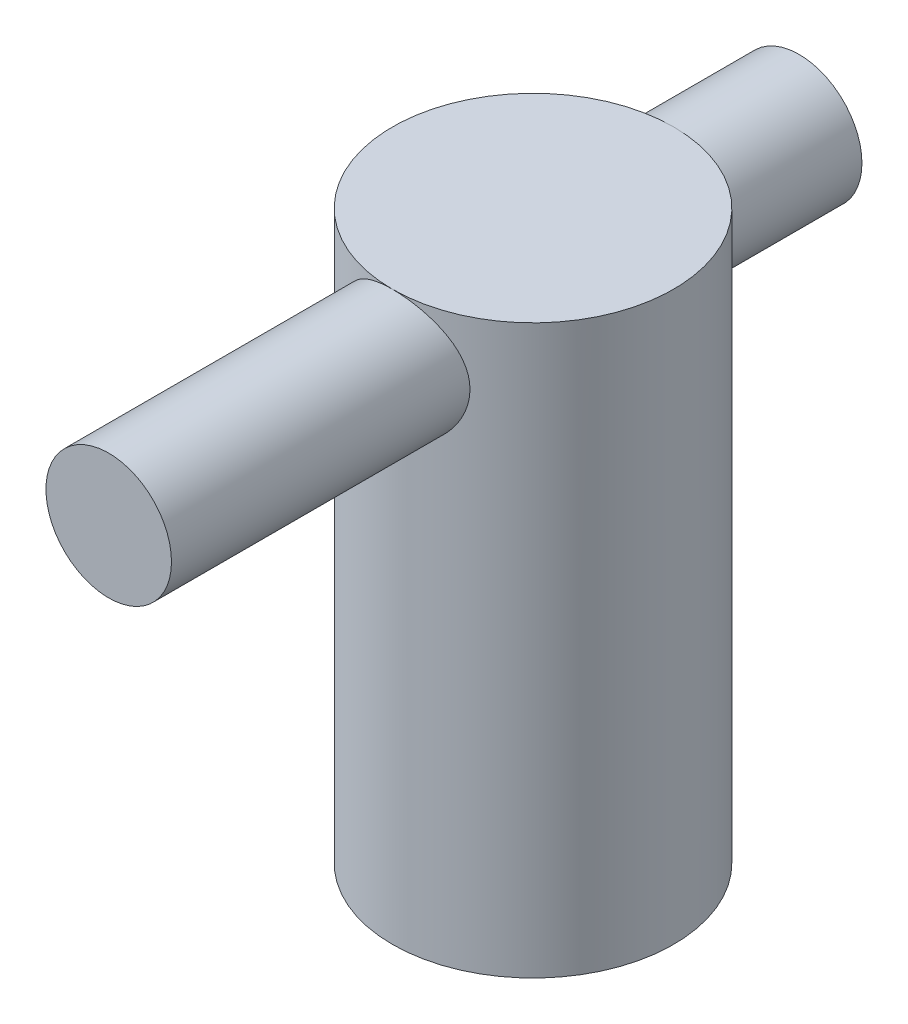
from build123d import *

# Parameters (mm, degrees)
SKETCH2_R                = 14.224
BOSS_EXTRUDE1_DEPTH      = 57.404
BOSS_EXTRUDE2_DEPTH      = 28.702
BOSS_EXTRUDE2_DEPTH_BACK = 41.148
SKETCH3_R                = 6.35


with BuildPart() as part:
    # Sketch2 → Boss-Extrude1 (new body)
    with BuildSketch(Plane(origin=(0, 0, 0), x_dir=(1, 0, 0), z_dir=(0, 1, 0))):
        with Locations(Location((0, 0, 0), (0, 0, 270))):
            Circle(SKETCH2_R)
    extrude(amount=BOSS_EXTRUDE1_DEPTH)

    # Sketch3 → Boss-Extrude2 (add, two sides: drawn at the far end of the back side and taken through both)
    with BuildSketch(Plane.XY.offset(14.224).offset(-BOSS_EXTRUDE2_DEPTH_BACK)):
        with Locations((0, 51.054)):
            Circle(SKETCH3_R)
    extrude(amount=BOSS_EXTRUDE2_DEPTH + BOSS_EXTRUDE2_DEPTH_BACK)


solid = part.part
